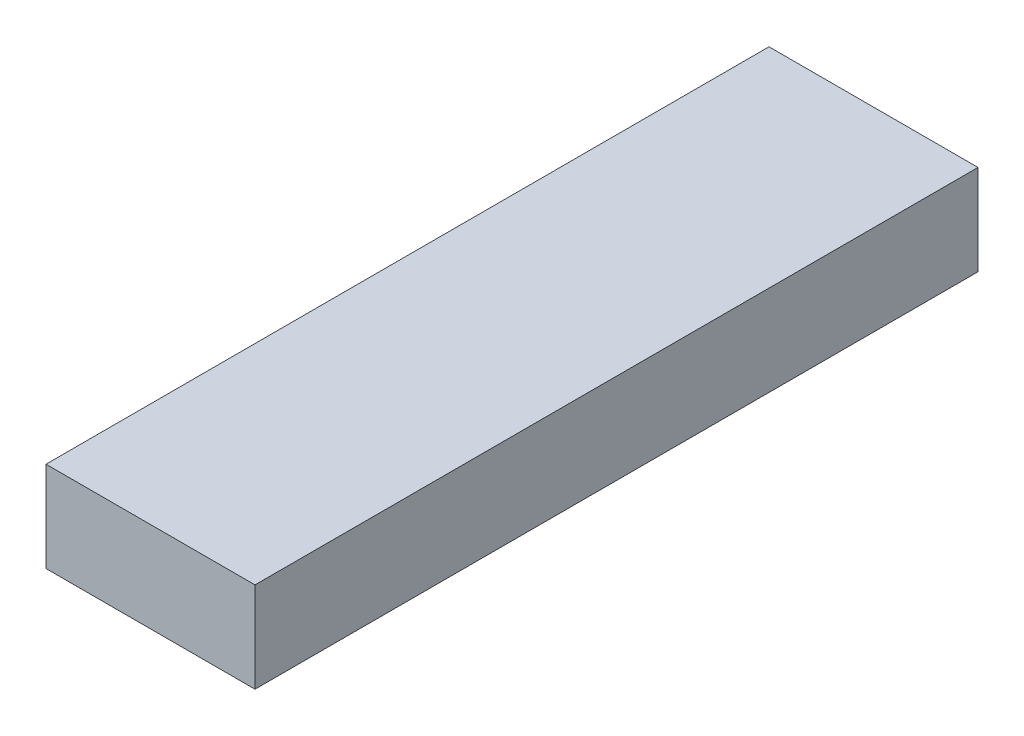
from build123d import *

# Parameters (mm, degrees)
SKETCH1_W           = 88.10625
SKETCH1_H           = 38.1
BOSS_EXTRUDE1_DEPTH = 304.8


with BuildPart() as part:
    # Sketch1 → Boss-Extrude1 (new body)
    with BuildSketch(Plane.XY):
        Rectangle(SKETCH1_W, SKETCH1_H)
    extrude(amount=BOSS_EXTRUDE1_DEPTH)


solid = part.part
